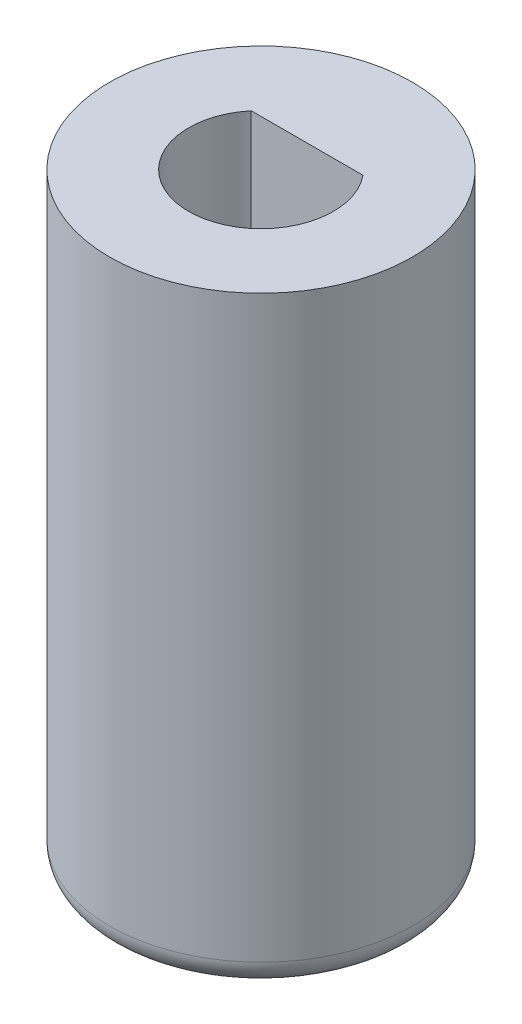
from build123d import *

# Parameters (mm, degrees)
SKETCH1_R           = 5.75
SKETCH1_R_2         = 2.75
BOSS_EXTRUDE1_DEPTH = 20
BOSS_EXTRUDE3_START = -20
BOSS_EXTRUDE3_DEPTH = 20
SKETCH2_R           = 1.1
CUT_EXTRUDE1_DEPTH  = 22.589928207
BOSS_EXTRUDE2_START = 3
SKETCH3_R           = 5.75
BOSS_EXTRUDE2_DEPTH = 3
FILLET1_R           = 1


with BuildPart() as part:
    # Sketch1 → Boss-Extrude1 (new body)
    with BuildSketch(Plane(origin=(0, 0, 0), x_dir=(1, 0, 0), z_dir=(0, 1, 0))):
        with Locations(Location((0, 0, 0), (0, 0, 270))):
            Circle(SKETCH1_R)
        with Locations(Location((0, 0, 0), (0, 0, 270))):
            Circle(SKETCH1_R_2, mode=Mode.SUBTRACT)
    extrude(amount=BOSS_EXTRUDE1_DEPTH)

    # Sketch5 → Boss-Extrude3 (add)
    with BuildSketch(Plane(origin=(0, 20, 0), x_dir=(1, 0, 0), z_dir=(0, 1, 0)).offset(BOSS_EXTRUDE3_START)):
        with BuildLine():
            Line((-2.121320344, 1.75), (2.121320344, 1.75))
            ThreePointArc((2.121320344, 1.75), (0, 2.75), (-2.121320344, 1.75))
        make_face()
    extrude(amount=BOSS_EXTRUDE3_DEPTH)

    # Sketch2 → Cut-Extrude1 (cut, through all)
    with BuildSketch(Plane.XY):
        with Locations((0, 10)):
            Circle(SKETCH2_R)
    extrude(amount=-CUT_EXTRUDE1_DEPTH, mode=Mode.SUBTRACT)

    # Sketch3 → Boss-Extrude2 (add)
    with BuildSketch(Plane.XZ.offset(BOSS_EXTRUDE2_START)):
        with Locations(Location((0, 0, 0), (0, 0, 270))):
            Circle(SKETCH3_R)
    extrude(amount=-BOSS_EXTRUDE2_DEPTH)

    # Fillet1
    fillet1_edges = [part.edges().sort_by_distance(p)[0] for p in [
        (0, -3, 5.75),
    ]]
    fillet(fillet1_edges, radius=FILLET1_R)


solid = part.part
